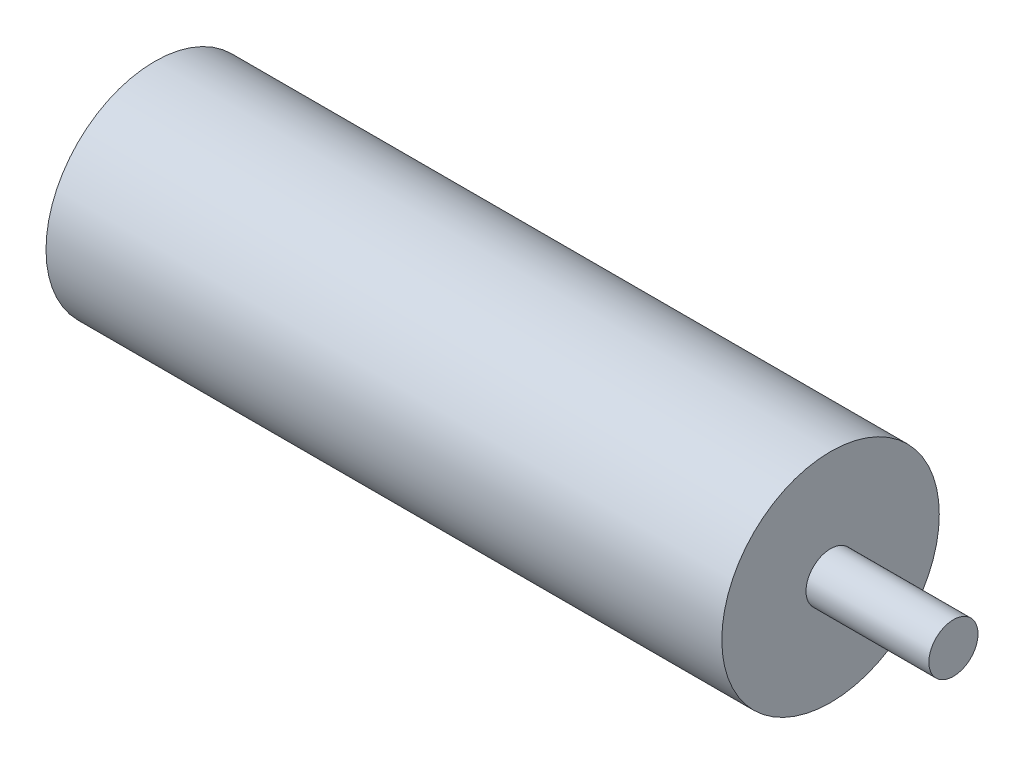
from build123d import *

# Parameters (mm, degrees)
SKETCH1_R           = 22.479
BOSS_EXTRUDE1_DEPTH = 139.7
SKETCH2_R           = 5.08
BOSS_EXTRUDE2_DEPTH = 25.4


with BuildPart() as part:
    # Sketch1 → Boss-Extrude1 (new body)
    with BuildSketch(Plane(origin=(0, 0, 0), x_dir=(0, 0, -1), z_dir=(1, 0, 0))):
        Circle(SKETCH1_R)
    extrude(amount=BOSS_EXTRUDE1_DEPTH)

    # Sketch2 → Boss-Extrude2 (add)
    with BuildSketch(Plane(origin=(139.7, 0, 0), x_dir=(0, 0, -1), z_dir=(1, 0, 0))):
        Circle(SKETCH2_R)
    extrude(amount=BOSS_EXTRUDE2_DEPTH)


solid = part.part
